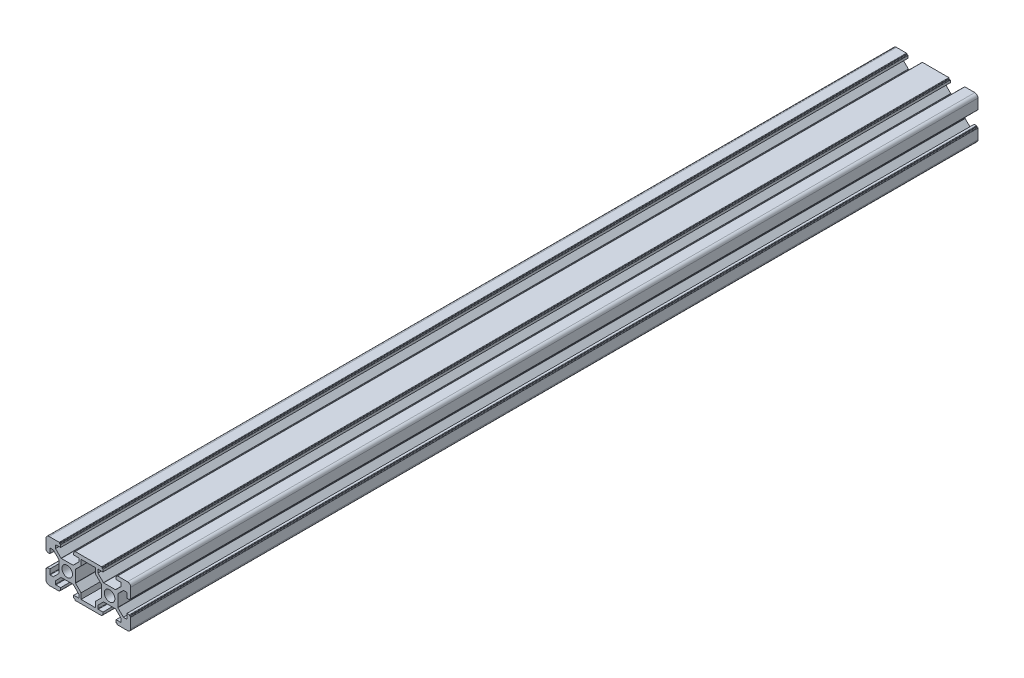
from build123d import *

# Parameters (mm, degrees)
BOSS_EXTRUDE1_DEPTH = 400
SKETCH2_R           = 2.5
CUT_EXTRUDE1_DEPTH  = 402.248052955


with BuildPart() as part:
    # Sketch1 → Boss-Extrude1 (new body)
    with BuildSketch(Plane.XY):
        with BuildLine():
            Line((-8.5, 10), (-3.8, 10))
            ThreePointArc((-3.8, 10), (-3.658578644, 9.941421356), (-3.6, 9.8))
            Line((-3.6, 9.8), (-3.6, 9.7))
            ThreePointArc((-3.6, 9.7), (-3.541421356, 9.558578644), (-3.4, 9.5))
            Line((-3.4, 9.5), (-3.3, 9.5))
            ThreePointArc((-3.3, 9.5), (-3.158578644, 9.441421356), (-3.1, 9.3))
            Line((-3.1, 9.3), (-3.1, 8.2))
            Line((-3.1, 8.2), (-5.3, 8.2))
            ThreePointArc((-5.3, 8.2), (-5.441421356, 8.141421356), (-5.5, 8))
            Line((-5.5, 8), (-5.5, 6.560660172))
            Line((-5.5, 6.560660172), (-2.897918472, 3.958578644))
            ThreePointArc((-2.897918472, 3.958578644), (-2.833033802, 3.915224093), (-2.756497116, 3.9))
            Line((-2.756497116, 3.9), (2.756497116, 3.9))
            ThreePointArc((2.756497116, 3.9), (2.833033802, 3.915224093), (2.897918472, 3.958578644))
            Line((2.897918472, 3.958578644), (5.5, 6.560660172))
            Line((5.5, 6.560660172), (5.5, 8))
            ThreePointArc((5.5, 8), (5.441421356, 8.141421356), (5.3, 8.2))
            Line((5.3, 8.2), (3.1, 8.2))
            Line((3.1, 8.2), (3.1, 9.3))
            ThreePointArc((3.1, 9.3), (3.158578644, 9.441421356), (3.3, 9.5))
            Line((3.3, 9.5), (3.4, 9.5))
            ThreePointArc((3.4, 9.5), (3.541421356, 9.558578644), (3.6, 9.7))
            Line((3.6, 9.7), (3.6, 9.8))
            ThreePointArc((3.6, 9.8), (3.658578644, 9.941421356), (3.8, 10))
            Line((3.8, 10), (8.5, 10))
            Line((8.5, 10), (11.5, 10))
            Line((11.5, 10), (16.2, 10))
            ThreePointArc((16.2, 10), (16.341421356, 9.941421356), (16.4, 9.8))
            Line((16.4, 9.8), (16.4, 9.7))
            ThreePointArc((16.4, 9.7), (16.458578644, 9.558578644), (16.6, 9.5))
            Line((16.6, 9.5), (16.7, 9.5))
            ThreePointArc((16.7, 9.5), (16.841421356, 9.441421356), (16.9, 9.3))
            Line((16.9, 9.3), (16.9, 8.2))
            Line((16.9, 8.2), (14.7, 8.2))
            ThreePointArc((14.7, 8.2), (14.558578644, 8.141421356), (14.5, 8))
            Line((14.5, 8), (14.5, 6.560660172))
            Line((14.5, 6.560660172), (17.102081528, 3.958578644))
            ThreePointArc((17.102081528, 3.958578644), (17.166966198, 3.915224093), (17.243502884, 3.9))
            Line((17.243502884, 3.9), (22.756497116, 3.9))
            ThreePointArc((22.756497116, 3.9), (22.833033802, 3.915224093), (22.897918472, 3.958578644))
            Line((22.897918472, 3.958578644), (25.5, 6.560660172))
            Line((25.5, 6.560660172), (25.5, 8))
            ThreePointArc((25.5, 8), (25.441421356, 8.141421356), (25.3, 8.2))
            Line((25.3, 8.2), (23.1, 8.2))
            Line((23.1, 8.2), (23.1, 9.3))
            ThreePointArc((23.1, 9.3), (23.158578644, 9.441421356), (23.3, 9.5))
            Line((23.3, 9.5), (23.4, 9.5))
            ThreePointArc((23.4, 9.5), (23.541421356, 9.558578644), (23.6, 9.7))
            Line((23.6, 9.7), (23.6, 9.8))
            ThreePointArc((23.6, 9.8), (23.658578644, 9.941421356), (23.8, 10))
            Line((23.8, 10), (28.5, 10))
            ThreePointArc((28.5, 10), (29.560660172, 9.560660172), (30, 8.5))
            Line((30, 8.5), (30, 3.8))
            ThreePointArc((30, 3.8), (29.941421356, 3.658578644), (29.8, 3.6))
            Line((29.8, 3.6), (29.7, 3.6))
            ThreePointArc((29.7, 3.6), (29.558578644, 3.541421356), (29.5, 3.4))
            Line((29.5, 3.4), (29.5, 3.3))
            ThreePointArc((29.5, 3.3), (29.441421356, 3.158578644), (29.3, 3.1))
            Line((29.3, 3.1), (28.2, 3.1))
            Line((28.2, 3.1), (28.2, 5.3))
            ThreePointArc((28.2, 5.3), (28.141421356, 5.441421356), (28, 5.5))
            Line((28, 5.5), (26.560660172, 5.5))
            Line((26.560660172, 5.5), (23.958578644, 2.897918472))
            ThreePointArc((23.958578644, 2.897918472), (23.915224093, 2.833033802), (23.9, 2.756497116))
            Line((23.9, 2.756497116), (23.9, -2.756497116))
            ThreePointArc((23.9, -2.756497116), (23.915224093, -2.833033802), (23.958578644, -2.897918472))
            Line((23.958578644, -2.897918472), (26.560660172, -5.5))
            Line((26.560660172, -5.5), (28, -5.5))
            ThreePointArc((28, -5.5), (28.141421356, -5.441421356), (28.2, -5.3))
            Line((28.2, -5.3), (28.2, -3.1))
            Line((28.2, -3.1), (29.3, -3.1))
            ThreePointArc((29.3, -3.1), (29.441421356, -3.158578644), (29.5, -3.3))
            Line((29.5, -3.3), (29.5, -3.4))
            ThreePointArc((29.5, -3.4), (29.558578644, -3.541421356), (29.7, -3.6))
            Line((29.7, -3.6), (29.8, -3.6))
            ThreePointArc((29.8, -3.6), (29.941421356, -3.658578644), (30, -3.8))
            Line((30, -3.8), (30, -8.5))
            ThreePointArc((30, -8.5), (29.560660172, -9.560660172), (28.5, -10))
            Line((28.5, -10), (23.8, -10))
            ThreePointArc((23.8, -10), (23.658578644, -9.941421356), (23.6, -9.8))
            Line((23.6, -9.8), (23.6, -9.7))
            ThreePointArc((23.6, -9.7), (23.541421356, -9.558578644), (23.4, -9.5))
            Line((23.4, -9.5), (23.3, -9.5))
            ThreePointArc((23.3, -9.5), (23.158578644, -9.441421356), (23.1, -9.3))
            Line((23.1, -9.3), (23.1, -8.2))
            Line((23.1, -8.2), (25.3, -8.2))
            ThreePointArc((25.3, -8.2), (25.441421356, -8.141421356), (25.5, -8))
            Line((25.5, -8), (25.5, -6.560660172))
            Line((25.5, -6.560660172), (22.897918472, -3.958578644))
            ThreePointArc((22.897918472, -3.958578644), (22.833033802, -3.915224093), (22.756497116, -3.9))
            Line((22.756497116, -3.9), (17.243502884, -3.9))
            ThreePointArc((17.243502884, -3.9), (17.166966198, -3.915224093), (17.102081528, -3.958578644))
            Line((17.102081528, -3.958578644), (14.5, -6.560660172))
            Line((14.5, -6.560660172), (14.5, -8))
            ThreePointArc((14.5, -8), (14.558578644, -8.141421356), (14.7, -8.2))
            Line((14.7, -8.2), (16.9, -8.2))
            Line((16.9, -8.2), (16.9, -9.3))
            ThreePointArc((16.9, -9.3), (16.841421356, -9.441421356), (16.7, -9.5))
            Line((16.7, -9.5), (16.6, -9.5))
            ThreePointArc((16.6, -9.5), (16.458578644, -9.558578644), (16.4, -9.7))
            Line((16.4, -9.7), (16.4, -9.8))
            ThreePointArc((16.4, -9.8), (16.341421356, -9.941421356), (16.2, -10))
            Line((16.2, -10), (11.5, -10))
            Line((11.5, -10), (8.5, -10))
            Line((8.5, -10), (3.8, -10))
            ThreePointArc((3.8, -10), (3.658578644, -9.941421356), (3.6, -9.8))
            Line((3.6, -9.8), (3.6, -9.7))
            ThreePointArc((3.6, -9.7), (3.541421356, -9.558578644), (3.4, -9.5))
            Line((3.4, -9.5), (3.3, -9.5))
            ThreePointArc((3.3, -9.5), (3.158578644, -9.441421356), (3.1, -9.3))
            Line((3.1, -9.3), (3.1, -8.2))
            Line((3.1, -8.2), (5.3, -8.2))
            ThreePointArc((5.3, -8.2), (5.441421356, -8.141421356), (5.5, -8))
            Line((5.5, -8), (5.5, -6.560660172))
            Line((5.5, -6.560660172), (2.897918472, -3.958578644))
            ThreePointArc((2.897918472, -3.958578644), (2.833033802, -3.915224093), (2.756497116, -3.9))
            Line((2.756497116, -3.9), (-2.756497116, -3.9))
            ThreePointArc((-2.756497116, -3.9), (-2.833033802, -3.915224093), (-2.897918472, -3.958578644))
            Line((-2.897918472, -3.958578644), (-5.5, -6.560660172))
            Line((-5.5, -6.560660172), (-5.5, -8))
            ThreePointArc((-5.5, -8), (-5.441421356, -8.141421356), (-5.3, -8.2))
            Line((-5.3, -8.2), (-3.1, -8.2))
            Line((-3.1, -8.2), (-3.1, -9.3))
            ThreePointArc((-3.1, -9.3), (-3.158578644, -9.441421356), (-3.3, -9.5))
            Line((-3.3, -9.5), (-3.4, -9.5))
            ThreePointArc((-3.4, -9.5), (-3.541421356, -9.558578644), (-3.6, -9.7))
            Line((-3.6, -9.7), (-3.6, -9.8))
            ThreePointArc((-3.6, -9.8), (-3.658578644, -9.941421356), (-3.8, -10))
            Line((-3.8, -10), (-8.5, -10))
            ThreePointArc((-8.5, -10), (-9.560660172, -9.560660172), (-10, -8.5))
            Line((-10, -8.5), (-10, -3.8))
            ThreePointArc((-10, -3.8), (-9.941421356, -3.658578644), (-9.8, -3.6))
            Line((-9.8, -3.6), (-9.7, -3.6))
            ThreePointArc((-9.7, -3.6), (-9.558578644, -3.541421356), (-9.5, -3.4))
            Line((-9.5, -3.4), (-9.5, -3.3))
            ThreePointArc((-9.5, -3.3), (-9.441421356, -3.158578644), (-9.3, -3.1))
            Line((-9.3, -3.1), (-8.2, -3.1))
            Line((-8.2, -3.1), (-8.2, -5.3))
            ThreePointArc((-8.2, -5.3), (-8.141421356, -5.441421356), (-8, -5.5))
            Line((-8, -5.5), (-6.560660172, -5.5))
            Line((-6.560660172, -5.5), (-3.958578644, -2.897918472))
            ThreePointArc((-3.958578644, -2.897918472), (-3.915224093, -2.833033802), (-3.9, -2.756497116))
            Line((-3.9, -2.756497116), (-3.9, 2.756497116))
            ThreePointArc((-3.9, 2.756497116), (-3.915224093, 2.833033802), (-3.958578644, 2.897918472))
            Line((-3.958578644, 2.897918472), (-6.560660172, 5.5))
            Line((-6.560660172, 5.5), (-8, 5.5))
            ThreePointArc((-8, 5.5), (-8.141421356, 5.441421356), (-8.2, 5.3))
            Line((-8.2, 5.3), (-8.2, 3.1))
            Line((-8.2, 3.1), (-9.3, 3.1))
            ThreePointArc((-9.3, 3.1), (-9.441421356, 3.158578644), (-9.5, 3.3))
            Line((-9.5, 3.3), (-9.5, 3.4))
            ThreePointArc((-9.5, 3.4), (-9.558578644, 3.541421356), (-9.7, 3.6))
            Line((-9.7, 3.6), (-9.8, 3.6))
            ThreePointArc((-9.8, 3.6), (-9.941421356, 3.658578644), (-10, 3.8))
            Line((-10, 3.8), (-10, 8.5))
            ThreePointArc((-10, 8.5), (-9.560660172, 9.560660172), (-8.5, 10))
        make_face()
        with BuildLine():
            Line((3.9, 2.756497116), (3.9, -2.756497116))
            ThreePointArc((3.9, -2.756497116), (3.915224093, -2.833033802), (3.958578644, -2.897918472))
            Line((3.958578644, -2.897918472), (6.560660172, -5.5))
            Line((6.560660172, -5.5), (6.560660172, -8.2))
            Line((6.560660172, -8.2), (13.439339828, -8.2))
            Line((13.439339828, -8.2), (13.439339828, -5.5))
            Line((13.439339828, -5.5), (16.041421356, -2.897918472))
            ThreePointArc((16.041421356, -2.897918472), (16.084775907, -2.833033802), (16.1, -2.756497116))
            Line((16.1, -2.756497116), (16.1, 2.756497116))
            ThreePointArc((16.1, 2.756497116), (16.084775907, 2.833033802), (16.041421356, 2.897918472))
            Line((16.041421356, 2.897918472), (13.439339828, 5.5))
            Line((13.439339828, 5.5), (13.439339828, 8.2))
            Line((13.439339828, 8.2), (6.560660172, 8.2))
            Line((6.560660172, 8.2), (6.560660172, 5.5))
            Line((6.560660172, 5.5), (3.958578644, 2.897918472))
            ThreePointArc((3.958578644, 2.897918472), (3.915224093, 2.833033802), (3.9, 2.756497116))
        make_face(mode=Mode.SUBTRACT)
    extrude(amount=BOSS_EXTRUDE1_DEPTH)

    # Sketch2 → Cut-Extrude1 (cut, through all)
    with BuildSketch(Plane.XY.offset(400)):
        Circle(SKETCH2_R)
        with Locations(Location((20, 0, 0), (0, 0, 180))):
            Circle(SKETCH2_R)
    extrude(amount=-CUT_EXTRUDE1_DEPTH, mode=Mode.SUBTRACT)


solid = part.part
